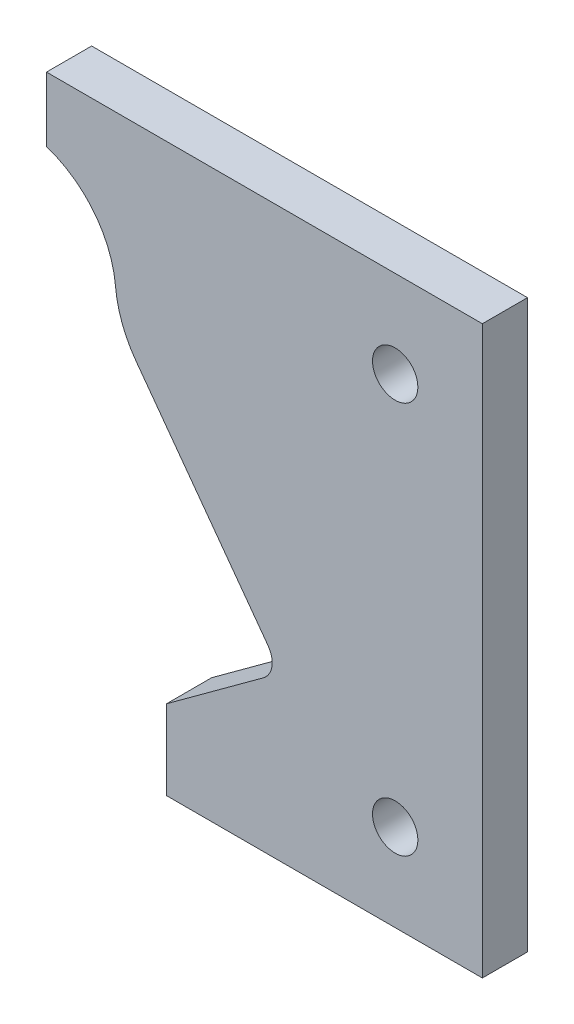
from build123d import *

# Parameters (mm, degrees)
BOSS_EXTRUDE1_DEPTH        = 3.2893
FILLET1_R                  = 3.175
F_97_0_26_DIAMETER_HOLE1_D = 6.604


with BuildPart() as part:
    # Sketch1 → Boss-Extrude1 (new, symmetric)
    with BuildSketch(Plane.XY):
        with BuildLine():
            Line((26.092747392, -18.613926775), (9.438661748, -30.801947025))
            Line((9.438661748, -30.801947025), (9.438661748, -42.398036845))
            Line((9.438661748, -42.398036845), (55.450257601, -42.398036845))
            Line((55.450257601, -42.398036845), (55.450257601, 40.151963155))
            Line((55.450257601, 40.151963155), (-8.049742399, 40.151963155))
            Line((-8.049742399, 40.151963155), (-8.049742399, 30.753963155))
            ThreePointArc((-8.049742399, 30.753963155), (-1.129436116, 25.949070048), (2.010067235, 18.131068031))
            ThreePointArc((2.010067235, 18.131068031), (2.969578149, 13.959464366), (5.008768553, 10.19587023))
            Line((5.008768553, 10.19587023), (26.092747392, -18.613926775))
        make_face()
    extrude(amount=BOSS_EXTRUDE1_DEPTH, both=True)

    # Fillet1
    fillet1_edges = [part.edges().sort_by_distance(p)[0] for p in [
        (26.092747392, -18.613926775, 0),
    ]]
    fillet(fillet1_edges, radius=FILLET1_R)

    # #97 (0.26) Diameter Hole1 (through all)
    with Locations(Plane(origin=(42.750257601, 27.451963155, 3.2893), x_dir=(1, 0, 0), z_dir=(0, 0, 1))):
        with Locations((0, 0), (0, -57.15)):
            Hole(F_97_0_26_DIAMETER_HOLE1_D / 2)


solid = part.part
